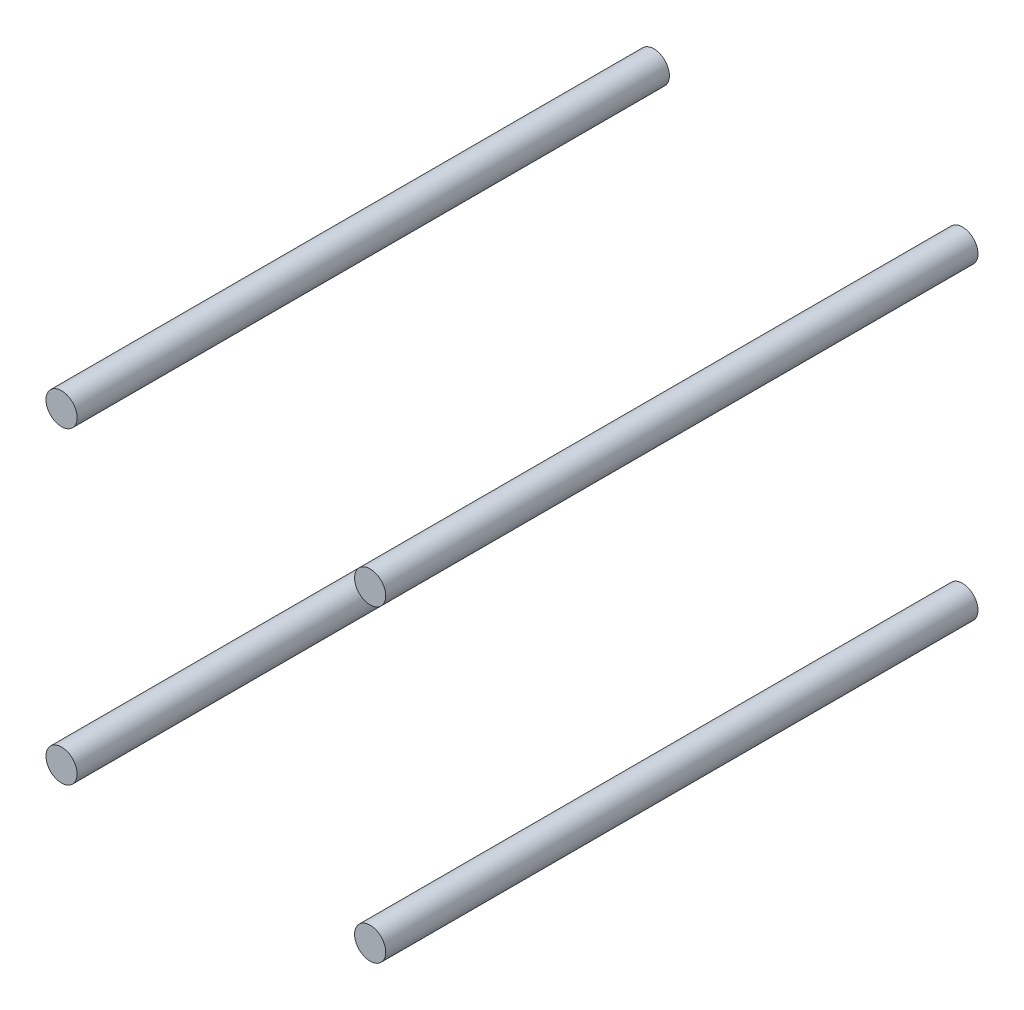
from build123d import *

# Parameters (mm, degrees)
SKETCH_1_R        = 2.5
EXTRUDE_1_DEPTH   = 95
EXTRUDE_1_2_DEPTH = 95
EXTRUDE_1_3_DEPTH = 95
EXTRUDE_1_4_DEPTH = 95


with BuildPart() as part:
    # 草图1 → 凸台-拉伸1 (new body)
    with BuildSketch(Plane.XY):
        with Locations((24.748737342, 24.748737342)):
            Circle(SKETCH_1_R)
    extrude(amount=-EXTRUDE_1_DEPTH)


with BuildPart() as body_2:
    # 草图1 → Extrude 1 2 (new body)
    with BuildSketch(Plane.XY):
        with Locations((-24.748737342, 24.748737342)):
            Circle(SKETCH_1_R)
    extrude(amount=-EXTRUDE_1_2_DEPTH)


with BuildPart() as body_3:
    # 草图1 → Extrude 1 3 (new body)
    with BuildSketch(Plane.XY):
        with Locations((-24.748737342, -24.748737342)):
            Circle(SKETCH_1_R)
    extrude(amount=-EXTRUDE_1_3_DEPTH)


with BuildPart() as body_4:
    # 草图1 → Extrude 1 4 (new body)
    with BuildSketch(Plane.XY):
        with Locations((24.748737342, -24.748737342)):
            Circle(SKETCH_1_R)
    extrude(amount=-EXTRUDE_1_4_DEPTH)


solid = Compound([part.part, body_2.part, body_3.part, body_4.part])
